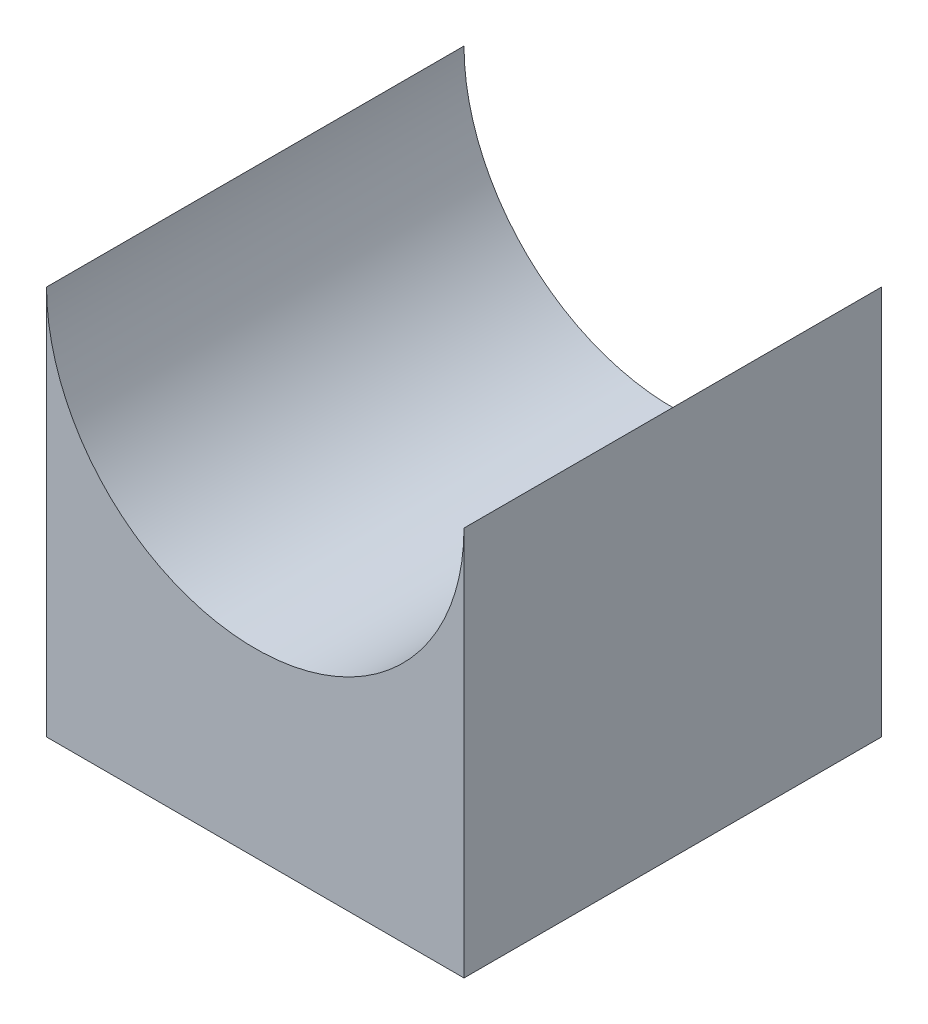
from build123d import *

# Parameters (mm, degrees)
EXTRUDE_1_DEPTH = 3


with BuildPart() as part:
    # 스케치1 → 보스-돌출1 (new body)
    with BuildSketch(Plane.XY):
        with BuildLine():
            Line((0, 0), (3, 0))
            Line((3, 0), (3, 2.8))
            ThreePointArc((3, 2.8), (1.5, 1.3), (0, 2.8))
            Line((0, 2.8), (0, 0))
        make_face()
    extrude(amount=EXTRUDE_1_DEPTH)


solid = part.part
